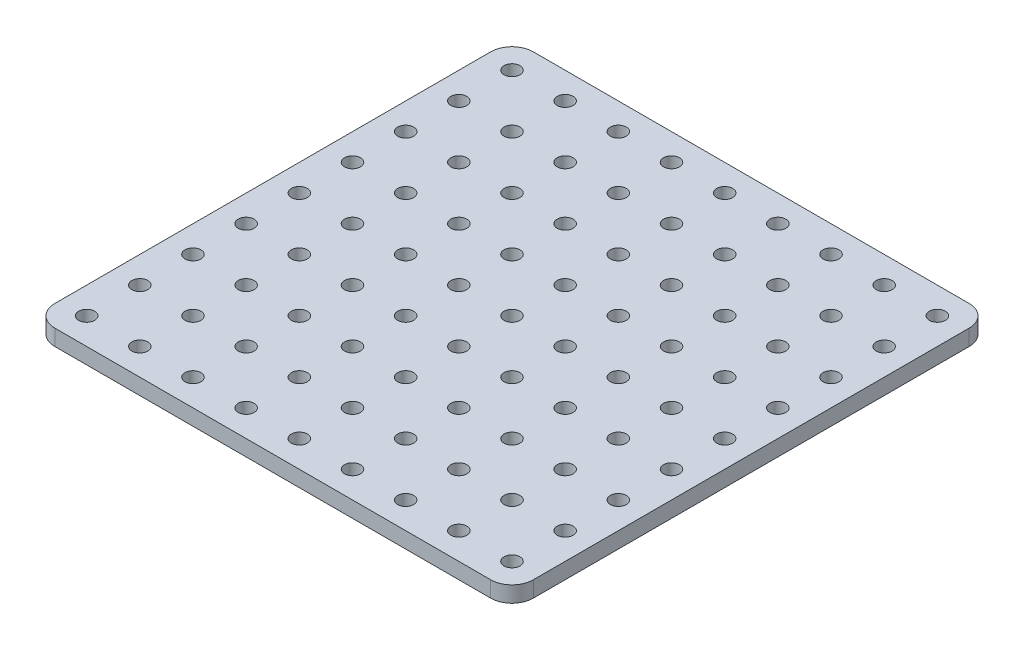
from build123d import *

# Parameters (mm, degrees)
SKETCH_1_W          = 90
SKETCH_1_H          = 90
EXTRUDE_1_DEPTH     = 3
SKETCH_2_R          = 1.5
CUT_EXTRUDE_1_DEPTH = 64.710281745
SKETCH_3_R          = 1.5
CUT_EXTRUDE_2_DEPTH = 64.710281745
SKETCH_5_R          = 1.5
CUT_EXTRUDE_3_DEPTH = 64.710281745
FILLET_1_R          = 4


with BuildPart() as part:
    # 草图1 → 凸台-拉伸1 (new body)
    with BuildSketch(Plane(origin=(0, 0, 0), x_dir=(1, 0, 0), z_dir=(0, 1, 0))):
        Rectangle(SKETCH_1_W, SKETCH_1_H)
    extrude(amount=EXTRUDE_1_DEPTH)

    # 草图2 → 切除-拉伸1 (cut, through all)
    with BuildSketch(Plane(origin=(0, 3, 0), x_dir=(1, 0, 0), z_dir=(0, 1, 0))):
        with Locations(Location((-40, 40, 0), (0, 0, 270))):
            Circle(SKETCH_2_R)
        with Locations(Location((40, 40, 0), (0, 0, 270))):
            Circle(SKETCH_2_R)
        with Locations(Location((40, -40, 0), (0, 0, 270))):
            Circle(SKETCH_2_R)
        with Locations(Location((-40, -40, 0), (0, 0, 270))):
            Circle(SKETCH_2_R)
    extrude(amount=-CUT_EXTRUDE_1_DEPTH, mode=Mode.SUBTRACT)

    # 草图3 → 切除-拉伸2 (cut, through all)
    with BuildSketch(Plane(origin=(0, 3, 0), x_dir=(1, 0, 0), z_dir=(0, 1, 0))):
        with Locations(Location((0, 0, 0), (0, 0, 270))):
            Circle(SKETCH_3_R)
        with Locations(Location((10, 0, 0), (0, 0, 270))):
            Circle(SKETCH_3_R)
        with Locations(Location((20, 0, 0), (0, 0, 270))):
            Circle(SKETCH_3_R)
        with Locations(Location((30, 0, 0), (0, 0, 270))):
            Circle(SKETCH_3_R)
        with Locations(Location((40, 0, 0), (0, 0, 270))):
            Circle(SKETCH_3_R)
        with Locations(Location((10, 10, 0), (0, 0, 270))):
            Circle(SKETCH_3_R)
        with Locations(Location((20, 10, 0), (0, 0, 270))):
            Circle(SKETCH_3_R)
        with Locations(Location((30, 10, 0), (0, 0, 270))):
            Circle(SKETCH_3_R)
        with Locations(Location((40, 10, 0), (0, 0, 270))):
            Circle(SKETCH_3_R)
        with Locations(Location((10, 20, 0), (0, 0, 270))):
            Circle(SKETCH_3_R)
        with Locations(Location((20, 20, 0), (0, 0, 270))):
            Circle(SKETCH_3_R)
        with Locations(Location((30, 20, 0), (0, 0, 270))):
            Circle(SKETCH_3_R)
        with Locations(Location((40, 20, 0), (0, 0, 270))):
            Circle(SKETCH_3_R)
        with Locations(Location((10, 30, 0), (0, 0, 270))):
            Circle(SKETCH_3_R)
        with Locations(Location((20, 30, 0), (0, 0, 270))):
            Circle(SKETCH_3_R)
        with Locations(Location((30, 30, 0), (0, 0, 270))):
            Circle(SKETCH_3_R)
        with Locations(Location((40, 30, 0), (0, 0, 270))):
            Circle(SKETCH_3_R)
        with Locations(Location((10, 40, 0), (0, 0, 270))):
            Circle(SKETCH_3_R)
        with Locations(Location((20, 40, 0), (0, 0, 270))):
            Circle(SKETCH_3_R)
        with Locations(Location((30, 40, 0), (0, 0, 270))):
            Circle(SKETCH_3_R)
        with Locations(Location((40, 40, 0), (0, 0, 270))):
            Circle(SKETCH_3_R)
        with Locations(Location((0, 10, 0), (0, 0, 270))):
            Circle(SKETCH_3_R)
        with Locations(Location((0, 20, 0), (0, 0, 270))):
            Circle(SKETCH_3_R)
        with Locations(Location((0, 30, 0), (0, 0, 270))):
            Circle(SKETCH_3_R)
        with Locations(Location((0, 40, 0), (0, 0, 270))):
            Circle(SKETCH_3_R)
        with Locations(Location((-10, 0, 0), (0, 0, 270))):
            Circle(SKETCH_3_R)
        with Locations(Location((-20, 0, 0), (0, 0, 270))):
            Circle(SKETCH_3_R)
        with Locations(Location((-30, 0, 0), (0, 0, 270))):
            Circle(SKETCH_3_R)
        with Locations(Location((-40, 0, 0), (0, 0, 270))):
            Circle(SKETCH_3_R)
        with Locations(Location((-10, -10, 0), (0, 0, 270))):
            Circle(SKETCH_3_R)
        with Locations(Location((-20, -10, 0), (0, 0, 270))):
            Circle(SKETCH_3_R)
        with Locations(Location((-30, -10, 0), (0, 0, 270))):
            Circle(SKETCH_3_R)
        with Locations(Location((-40, -10, 0), (0, 0, 270))):
            Circle(SKETCH_3_R)
        with Locations(Location((-10, -20, 0), (0, 0, 270))):
            Circle(SKETCH_3_R)
        with Locations(Location((-20, -20, 0), (0, 0, 270))):
            Circle(SKETCH_3_R)
        with Locations(Location((-30, -20, 0), (0, 0, 270))):
            Circle(SKETCH_3_R)
        with Locations(Location((-40, -20, 0), (0, 0, 270))):
            Circle(SKETCH_3_R)
        with Locations(Location((-10, -30, 0), (0, 0, 270))):
            Circle(SKETCH_3_R)
        with Locations(Location((-20, -30, 0), (0, 0, 270))):
            Circle(SKETCH_3_R)
        with Locations(Location((-30, -30, 0), (0, 0, 270))):
            Circle(SKETCH_3_R)
        with Locations(Location((-40, -30, 0), (0, 0, 270))):
            Circle(SKETCH_3_R)
        with Locations(Location((-10, -40, 0), (0, 0, 270))):
            Circle(SKETCH_3_R)
        with Locations(Location((-20, -40, 0), (0, 0, 270))):
            Circle(SKETCH_3_R)
        with Locations(Location((-30, -40, 0), (0, 0, 270))):
            Circle(SKETCH_3_R)
        with Locations(Location((-40, -40, 0), (0, 0, 270))):
            Circle(SKETCH_3_R)
        with Locations(Location((0, -10, 0), (0, 0, 270))):
            Circle(SKETCH_3_R)
        with Locations(Location((0, -20, 0), (0, 0, 270))):
            Circle(SKETCH_3_R)
        with Locations(Location((0, -30, 0), (0, 0, 270))):
            Circle(SKETCH_3_R)
        with Locations(Location((0, -40, 0), (0, 0, 270))):
            Circle(SKETCH_3_R)
    extrude(amount=-CUT_EXTRUDE_2_DEPTH, mode=Mode.SUBTRACT)

    # 草图5 → 切除-拉伸3 (cut, through all)
    with BuildSketch(Plane(origin=(0, 3, 0), x_dir=(1, 0, 0), z_dir=(0, 1, 0))):
        with Locations(Location((0, 0, 0), (0, 0, 270))):
            Circle(SKETCH_5_R)
        with Locations(Location((-10, 0, 0), (0, 0, 270))):
            Circle(SKETCH_5_R)
        with Locations(Location((-20, 0, 0), (0, 0, 270))):
            Circle(SKETCH_5_R)
        with Locations(Location((-30, 0, 0), (0, 0, 270))):
            Circle(SKETCH_5_R)
        with Locations(Location((-40, 0, 0), (0, 0, 270))):
            Circle(SKETCH_5_R)
        with Locations(Location((-10, 10, 0), (0, 0, 270))):
            Circle(SKETCH_5_R)
        with Locations(Location((-20, 10, 0), (0, 0, 270))):
            Circle(SKETCH_5_R)
        with Locations(Location((-30, 10, 0), (0, 0, 270))):
            Circle(SKETCH_5_R)
        with Locations(Location((-40, 10, 0), (0, 0, 270))):
            Circle(SKETCH_5_R)
        with Locations(Location((-10, 20, 0), (0, 0, 270))):
            Circle(SKETCH_5_R)
        with Locations(Location((-20, 20, 0), (0, 0, 270))):
            Circle(SKETCH_5_R)
        with Locations(Location((-30, 20, 0), (0, 0, 270))):
            Circle(SKETCH_5_R)
        with Locations(Location((-40, 20, 0), (0, 0, 270))):
            Circle(SKETCH_5_R)
        with Locations(Location((-10, 30, 0), (0, 0, 270))):
            Circle(SKETCH_5_R)
        with Locations(Location((-20, 30, 0), (0, 0, 270))):
            Circle(SKETCH_5_R)
        with Locations(Location((-30, 30, 0), (0, 0, 270))):
            Circle(SKETCH_5_R)
        with Locations(Location((-40, 30, 0), (0, 0, 270))):
            Circle(SKETCH_5_R)
        with Locations(Location((-10, 40, 0), (0, 0, 270))):
            Circle(SKETCH_5_R)
        with Locations(Location((-20, 40, 0), (0, 0, 270))):
            Circle(SKETCH_5_R)
        with Locations(Location((-30, 40, 0), (0, 0, 270))):
            Circle(SKETCH_5_R)
        with Locations(Location((-40, 40, 0), (0, 0, 270))):
            Circle(SKETCH_5_R)
        with Locations(Location((0, 10, 0), (0, 0, 270))):
            Circle(SKETCH_5_R)
        with Locations(Location((0, 20, 0), (0, 0, 270))):
            Circle(SKETCH_5_R)
        with Locations(Location((0, 30, 0), (0, 0, 270))):
            Circle(SKETCH_5_R)
        with Locations(Location((0, 40, 0), (0, 0, 270))):
            Circle(SKETCH_5_R)
        with Locations(Location((10, 0, 0), (0, 0, 270))):
            Circle(SKETCH_5_R)
        with Locations(Location((20, 0, 0), (0, 0, 270))):
            Circle(SKETCH_5_R)
        with Locations(Location((30, 0, 0), (0, 0, 270))):
            Circle(SKETCH_5_R)
        with Locations(Location((40, 0, 0), (0, 0, 270))):
            Circle(SKETCH_5_R)
        with Locations(Location((10, -10, 0), (0, 0, 270))):
            Circle(SKETCH_5_R)
        with Locations(Location((20, -10, 0), (0, 0, 270))):
            Circle(SKETCH_5_R)
        with Locations(Location((30, -10, 0), (0, 0, 270))):
            Circle(SKETCH_5_R)
        with Locations(Location((40, -10, 0), (0, 0, 270))):
            Circle(SKETCH_5_R)
        with Locations(Location((10, -20, 0), (0, 0, 270))):
            Circle(SKETCH_5_R)
        with Locations(Location((20, -20, 0), (0, 0, 270))):
            Circle(SKETCH_5_R)
        with Locations(Location((30, -20, 0), (0, 0, 270))):
            Circle(SKETCH_5_R)
        with Locations(Location((40, -20, 0), (0, 0, 270))):
            Circle(SKETCH_5_R)
        with Locations(Location((10, -30, 0), (0, 0, 270))):
            Circle(SKETCH_5_R)
        with Locations(Location((20, -30, 0), (0, 0, 270))):
            Circle(SKETCH_5_R)
        with Locations(Location((30, -30, 0), (0, 0, 270))):
            Circle(SKETCH_5_R)
        with Locations(Location((40, -30, 0), (0, 0, 270))):
            Circle(SKETCH_5_R)
        with Locations(Location((10, -40, 0), (0, 0, 270))):
            Circle(SKETCH_5_R)
        with Locations(Location((20, -40, 0), (0, 0, 270))):
            Circle(SKETCH_5_R)
        with Locations(Location((30, -40, 0), (0, 0, 270))):
            Circle(SKETCH_5_R)
        with Locations(Location((40, -40, 0), (0, 0, 270))):
            Circle(SKETCH_5_R)
        with Locations(Location((0, -10, 0), (0, 0, 270))):
            Circle(SKETCH_5_R)
        with Locations(Location((0, -20, 0), (0, 0, 270))):
            Circle(SKETCH_5_R)
        with Locations(Location((0, -30, 0), (0, 0, 270))):
            Circle(SKETCH_5_R)
        with Locations(Location((0, -40, 0), (0, 0, 270))):
            Circle(SKETCH_5_R)
    extrude(amount=-CUT_EXTRUDE_3_DEPTH, mode=Mode.SUBTRACT)

    # 圆角1
    fillet_1_edges = [part.edges().sort_by_distance(p)[0] for p in [
        (45, 1.5, 45),
        (-45, 1.5, 45),
        (-45, 1.5, -45),
        (45, 1.5, -45),
    ]]
    fillet(fillet_1_edges, radius=FILLET_1_R)


solid = part.part
